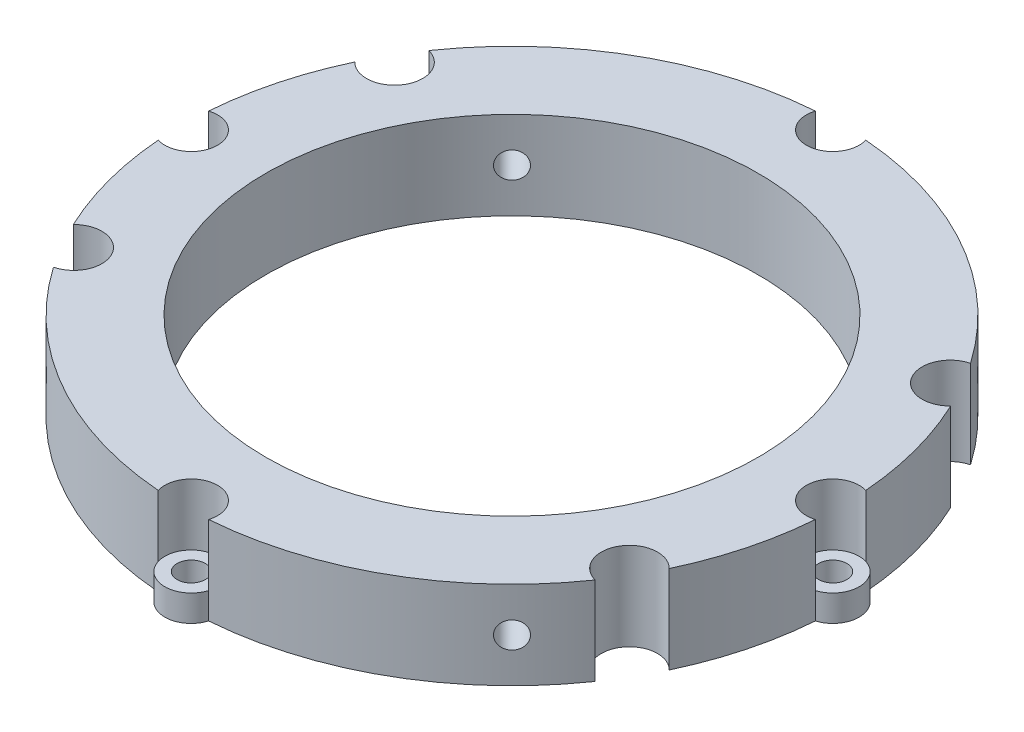
from build123d import *

# Parameters (mm, degrees)
IZIM2_R                     = 28
Y_KSEKLIK_EKSTR_ZYON5_DEPTH = 10
IZIM3_R                     = 1.49
KES_EKSTR_ZYON1_DEPTH       = 54.801017528
DAIRESEL_KAPLAMA1_COUNT     = 4
IZIM4_R                     = 3
IZIM4_R_2                   = 1.6
Y_KSEKLIK_EKSTR_ZYON6_DEPTH = 3
DAIRESEL_KAPLAMA2_COUNT     = 4


with BuildPart() as part:
    # Çizim2 → Yükseklik-Ekstrüzyon5 (new body)
    with BuildSketch(Plane(origin=(0, 0, 0), x_dir=(1, 0, 0), z_dir=(0, 1, 0))):
        with BuildLine():
            ThreePointArc((-37.380138356, -2.867988228), (-36.240115286, -9.599694998), (-33.898134186, -16.013013418))
            ThreePointArc((-33.898134186, -16.013013418), (-28.838645946, -16.65), (-30.816743504, -21.350138636))
            ThreePointArc((-30.816743504, -21.350138636), (-18.652225356, -32.52067941), (-2.867988228, -37.380138356))
            ThreePointArc((-2.867988228, -37.380138356), (0, -33.5), (2.867988228, -37.380138356))
            ThreePointArc((2.867988228, -37.380138356), (18.652225356, -32.52067941), (30.816743504, -21.350138636))
            ThreePointArc((30.816743504, -21.350138636), (28.838645946, -16.65), (33.898134186, -16.013013418))
            ThreePointArc((33.898134186, -16.013013418), (36.240115286, -9.599694998), (37.380138356, -2.867988228))
            ThreePointArc((37.380138356, -2.867988228), (33.5, 0), (37.380138356, 2.867988228))
            ThreePointArc((37.380138356, 2.867988228), (36.240115286, 9.599694998), (33.898134186, 16.013013418))
            ThreePointArc((33.898134186, 16.013013418), (28.838645946, 16.65), (30.816743504, 21.350138636))
            ThreePointArc((30.816743504, 21.350138636), (18.652225356, 32.52067941), (2.867988228, 37.380138356))
            ThreePointArc((2.867988228, 37.380138356), (0, 33.5), (-2.867988228, 37.380138356))
            ThreePointArc((-2.867988228, 37.380138356), (-18.652225356, 32.52067941), (-30.816743504, 21.350138636))
            ThreePointArc((-30.816743504, 21.350138636), (-28.838645946, 16.65), (-33.898134186, 16.013013418))
            ThreePointArc((-33.898134186, 16.013013418), (-36.240115286, 9.599694998), (-37.380138356, 2.867988228))
            ThreePointArc((-37.380138356, 2.867988228), (-33.5, 0), (-37.380138356, -2.867988228))
        make_face()
        Circle(IZIM2_R, mode=Mode.SUBTRACT)
    extrude(amount=Y_KSEKLIK_EKSTR_ZYON5_DEPTH)

    # Çizim3 → Kes-Ekstrüzyon1 (cut, through all)
    with BuildSketch(Plane(origin=(0, 0, 0), x_dir=(0.7071067811865464, 0, 0.7071067811865488), z_dir=(-0.7071067811865488, 0, 0.7071067811865464))):
        with Locations((0, 5)):
            Circle(IZIM3_R)
    kes_ekstr_zyon1 = extrude(amount=-KES_EKSTR_ZYON1_DEPTH, mode=Mode.SUBTRACT)

    # Dairesel Kaplama1: Kes-Ekstrüzyon1 ×4 about axis
    dairesel_kaplama1_axis = Axis((0, 31.917325532, 0), (0, -1, 0))
    for i in range(1, DAIRESEL_KAPLAMA1_COUNT):
        add(kes_ekstr_zyon1.rotate(dairesel_kaplama1_axis, i * 360 / DAIRESEL_KAPLAMA1_COUNT), mode=Mode.SUBTRACT)

    # Çizim4 → Yükseklik-Ekstrüzyon6 (add)
    with BuildSketch(Plane(origin=(0, 0, 0), x_dir=(1, 0, 0), z_dir=(0, 1, 0))):
        with Locations((-36.5, 0)):
            Circle(IZIM4_R)
        with Locations((-36.5, 0)):
            Circle(IZIM4_R_2, mode=Mode.SUBTRACT)
    y_kseklik_ekstr_zyon6 = extrude(amount=Y_KSEKLIK_EKSTR_ZYON6_DEPTH)

    # Dairesel Kaplama2: Yükseklik-Ekstrüzyon6 ×4 about axis
    dairesel_kaplama2_axis = Axis((0, 31.917325532, 0), (0, -1, 0))
    for i in range(1, DAIRESEL_KAPLAMA2_COUNT):
        add(y_kseklik_ekstr_zyon6.rotate(dairesel_kaplama2_axis, i * 360 / DAIRESEL_KAPLAMA2_COUNT))


solid = part.part
